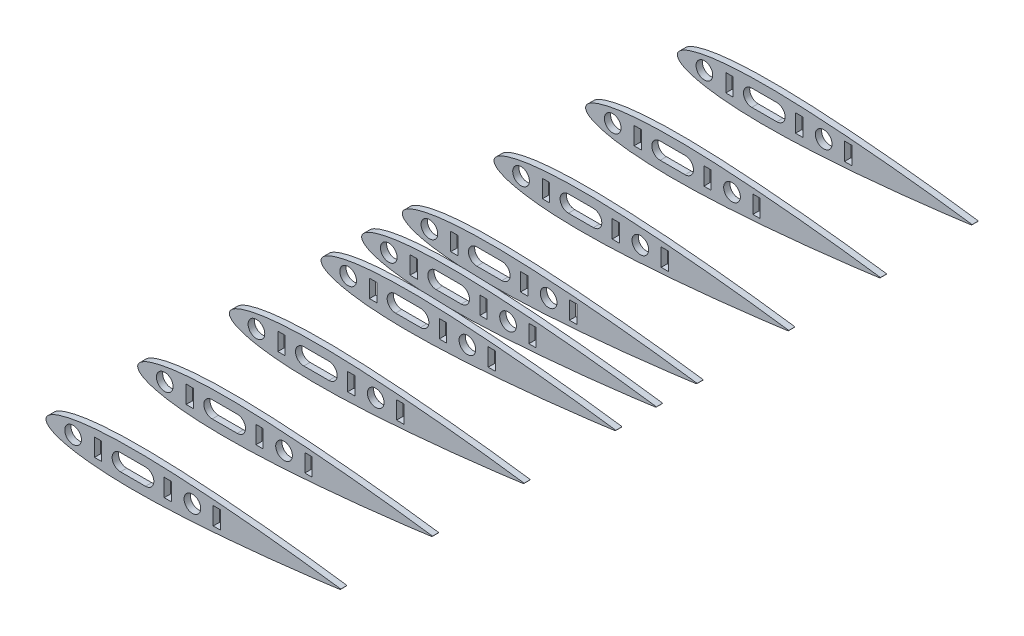
from build123d import *

# Parameters (mm, degrees)
SKETCH1_R           = 4
SKETCH1_W           = 8.5
SKETCH1_H           = 3.5
BOSS_EXTRUDE1_DEPTH = 1.5
LPATTERN1_COUNT     = 2
LPATTERN1_PITCH     = 19.5
LPATTERN1_2_COUNT   = 2
LPATTERN1_2_PITCH   = 19.5
LPATTERN2_COUNT     = 4
LPATTERN2_PITCH     = 44
LPATTERN3_COUNT     = 4
LPATTERN3_PITCH     = 44


with BuildPart() as part:
    # Sketch1 → Boss-Extrude1 (new, symmetric)
    with BuildSketch(Plane(origin=(0, 0, 0), x_dir=(0, 1, 0), z_dir=(0, 0, 1))):
        with BuildLine():
            add(Edge.make_bspline(
                [(0, 0), (-0.203054183, 0), (-0.619599238, -0.058189611), (-1.223381516, -0.319177309), (-1.804480924, -0.745665581), (-2.365419582, -1.332477213), (-2.908167736, -2.07771354), (-3.43324396, -2.980289459), (-3.940051667, -4.03888404), (-4.427442033, -5.251620375), (-4.893964332, -6.616092539), (-5.338055618, -8.129388245), (-5.758042772, -9.788176996), (-6.152401123, -11.588693438), (-6.519510646, -13.526840267), (-6.858035653, -15.598137035), (-7.166586843, -17.797803271), (-7.444122565, -20.120722681), (-7.689651459, -22.561496745), (-7.902490344, -25.114434075), (-8.082146894, -27.773586042), (-8.22831947, -30.532757863), (-8.341040732, -33.385507228), (-8.420521404, -36.325173668), (-8.467195798, -39.344896848), (-8.481786451, -42.437631497), (-8.465165845, -45.596154235), (-8.418420877, -48.813090151), (-8.342818147, -52.080927803), (-8.239794783, -55.392043724), (-8.110855526, -58.738704268), (-7.957659229, -62.11309231), (-7.781944702, -65.507329821), (-7.585482152, -68.913494987), (-7.370096764, -72.323634051), (-7.137619982, -75.72978309), (-6.889877086, -79.123991189), (-6.6287251, -82.498330057), (-6.355911519, -85.844921175), (-6.07321847, -89.155943158), (-5.782359307, -92.423675321), (-5.485006554, -95.640476351), (-5.182828885, -98.798841274), (-4.877364021, -101.891383159), (-4.570198591, -104.910893671), (-4.262826047, -107.850307689), (-3.956757783, -110.70276752), (-3.653482749, -113.461605248), (-3.354359815, -116.120375202), (-3.060908922, -118.672878264), (-2.774494699, -121.113147954), (-2.496524334, -123.435484638), (-2.228367463, -125.634457833), (-1.971429716, -127.704940952), (-1.727006471, -129.642092799), (-1.496464848, -131.441392711), (-1.280990573, -133.09863095), (-1.081896104, -134.609942335), (-0.900287956, -135.971811066), (-0.737191818, -137.181002969), (-0.593928842, -138.234866349), (-0.470348015, -139.130422969), (-0.370271877, -139.867056543), (-0.286169617, -140.439105614), (-0.238454011, -140.854805879), (-0.18681899, -141.093615278), (-0.191485432, -141.338567882), (0.191485432, -141.338567882), (0.18681899, -141.093615278), (0.238454011, -140.854805879), (0.286169617, -140.439105614), (0.370271877, -139.867056543), (0.470348015, -139.130422969), (0.593928842, -138.234866349), (0.737191818, -137.181002969), (0.900287956, -135.971811066), (1.081896104, -134.609942335), (1.280990573, -133.09863095), (1.496464848, -131.441392711), (1.727006471, -129.642092799), (1.971429716, -127.704940952), (2.228367463, -125.634457833), (2.496524334, -123.435484638), (2.774494699, -121.113147954), (3.060908922, -118.672878264), (3.354359815, -116.120375202), (3.653482749, -113.461605248), (3.956757783, -110.70276752), (4.262826047, -107.850307689), (4.570198591, -104.910893671), (4.877364021, -101.891383159), (5.182828885, -98.798841274), (5.485006554, -95.640476351), (5.782359307, -92.423675321), (6.07321847, -89.155943158), (6.355911519, -85.844921175), (6.6287251, -82.498330057), (6.889877086, -79.123991189), (7.137619982, -75.72978309), (7.370096764, -72.323634051), (7.585482152, -68.913494987), (7.781944702, -65.507329821), (7.957659229, -62.11309231), (8.110855526, -58.738704268), (8.239794783, -55.392043724), (8.342818147, -52.080927803), (8.418420877, -48.813090151), (8.465165845, -45.596154235), (8.481786451, -42.437631497), (8.467195798, -39.344896848), (8.420521404, -36.325173668), (8.341040732, -33.385507228), (8.22831947, -30.532757863), (8.082146894, -27.773586042), (7.902490344, -25.114434075), (7.689651459, -22.561496745), (7.444122565, -20.120722681), (7.166586843, -17.797803271), (6.858035653, -15.598137035), (6.519510646, -13.526840267), (6.152401123, -11.588693438), (5.758042772, -9.788176996), (5.338055618, -8.129388245), (4.893964332, -6.616092539), (4.427442033, -5.251620375), (3.940051667, -4.03888404), (3.43324396, -2.980289459), (2.908167736, -2.07771354), (2.365419582, -1.332477213), (1.804480924, -0.745665581), (1.223381516, -0.319177309), (0.619599238, -0.058189611), (0.203054183, 0), (0, 0)],
                knots=[0, 0, 0, 0, 0.002106168, 0.00432059, 0.006772783, 0.009556697, 0.012734041, 0.016342888, 0.020405604, 0.024934102, 0.029933071, 0.035402241, 0.04133743, 0.04773159, 0.054575389, 0.061857405, 0.069564571, 0.077682311, 0.086194684, 0.095084441, 0.104333244, 0.1139217, 0.123829339, 0.134034708, 0.144515531, 0.155248716, 0.166210356, 0.177375783, 0.188719821, 0.200216647, 0.211839951, 0.223562989, 0.235358653, 0.247199625, 0.259058395, 0.270907226, 0.282718457, 0.294464514, 0.306117689, 0.317650771, 0.329036618, 0.34024851, 0.351259999, 0.362045273, 0.372578891, 0.382836142, 0.392792739, 0.40242532, 0.411711115, 0.420628244, 0.429155673, 0.437273179, 0.444961561, 0.452202575, 0.458979063, 0.465274876, 0.471074963, 0.476365569, 0.481133961, 0.485368768, 0.489059784, 0.492198148, 0.494776266, 0.49678801, 0.498228425, 0.499094073, 0.499382862, 0.500617138, 0.500905927, 0.501771575, 0.50321199, 0.505223734, 0.507801852, 0.510940216, 0.514631232, 0.518866039, 0.523634431, 0.528925037, 0.534725124, 0.541020937, 0.547797425, 0.555038439, 0.562726821, 0.570844327, 0.579371756, 0.588288885, 0.59757468, 0.607207261, 0.617163858, 0.627421109, 0.637954727, 0.648740001, 0.65975149, 0.670963382, 0.682349229, 0.693882311, 0.705535486, 0.717281543, 0.729092774, 0.740941605, 0.752800375, 0.764641347, 0.776437011, 0.788160049, 0.799783353, 0.811280179, 0.822624217, 0.833789644, 0.844751284, 0.855484469, 0.865965292, 0.876170661, 0.8860783, 0.895666756, 0.904915559, 0.913805316, 0.922317689, 0.930435429, 0.938142595, 0.945424611, 0.95226841, 0.95866257, 0.964597759, 0.970066929, 0.975065898, 0.979594396, 0.983657112, 0.987265959, 0.990443303, 0.993227217, 0.99567941, 0.997893832, 1, 1, 1, 1], degree=3))
        make_face()
        with Locations(Location((0, -70.25, 0), (0, 0, 270))):
            Circle(SKETCH1_R, mode=Mode.SUBTRACT)
        with Locations(Location((0, -13, 0), (0, 0, 270))):
            Circle(SKETCH1_R, mode=Mode.SUBTRACT)
        with Locations((0, -58.5)):
            Rectangle(SKETCH1_W, SKETCH1_H, mode=Mode.SUBTRACT)
        with Locations((0, -25)):
            Rectangle(SKETCH1_W, SKETCH1_H, mode=Mode.SUBTRACT)
        with Locations((0, -82)):
            Rectangle(SKETCH1_W, SKETCH1_H, mode=Mode.SUBTRACT)
        with BuildLine():
            Line((-4, -47.75), (-4, -35.75))
            ThreePointArc((-4, -35.75), (0, -31.75), (4, -35.75))
            Line((4, -35.75), (4, -47.75))
            ThreePointArc((4, -47.75), (0, -51.75), (-4, -47.75))
        make_face(mode=Mode.SUBTRACT)
    extrude(amount=BOSS_EXTRUDE1_DEPTH, both=True)


with BuildPart() as lpattern1_1:
    # LPattern1: pattern copy
    add(part.part.moved(Location(Vector(0, 0, 1) * (1 * LPATTERN1_PITCH))))


with BuildPart() as lpattern1_2_1:
    # LPattern1 2: pattern copy
    add(part.part.moved(Location(Vector(0, 0, -1) * (1 * LPATTERN1_2_PITCH))))


with BuildPart() as lpattern2_1:
    # LPattern2: pattern copy
    add(lpattern1_2_1.part.moved(Location(Vector(0, 0, -1) * (1 * LPATTERN2_PITCH))))


with BuildPart() as lpattern2_2:
    # LPattern2: pattern copy
    add(lpattern1_2_1.part.moved(Location(Vector(0, 0, -1) * (2 * LPATTERN2_PITCH))))


with BuildPart() as lpattern2_3:
    # LPattern2: pattern copy
    add(lpattern1_2_1.part.moved(Location(Vector(0, 0, -1) * (3 * LPATTERN2_PITCH))))


with BuildPart() as lpattern3_1:
    # LPattern3: pattern copy
    add(lpattern1_1.part.moved(Location(Vector(0, 0, 1) * (1 * LPATTERN3_PITCH))))


with BuildPart() as lpattern3_2:
    # LPattern3: pattern copy
    add(lpattern1_1.part.moved(Location(Vector(0, 0, 1) * (2 * LPATTERN3_PITCH))))


with BuildPart() as lpattern3_3:
    # LPattern3: pattern copy
    add(lpattern1_1.part.moved(Location(Vector(0, 0, 1) * (3 * LPATTERN3_PITCH))))


solid = Compound([part.part, lpattern1_1.part, lpattern1_2_1.part, lpattern2_1.part, lpattern2_2.part, lpattern2_3.part, lpattern3_1.part, lpattern3_2.part, lpattern3_3.part])
